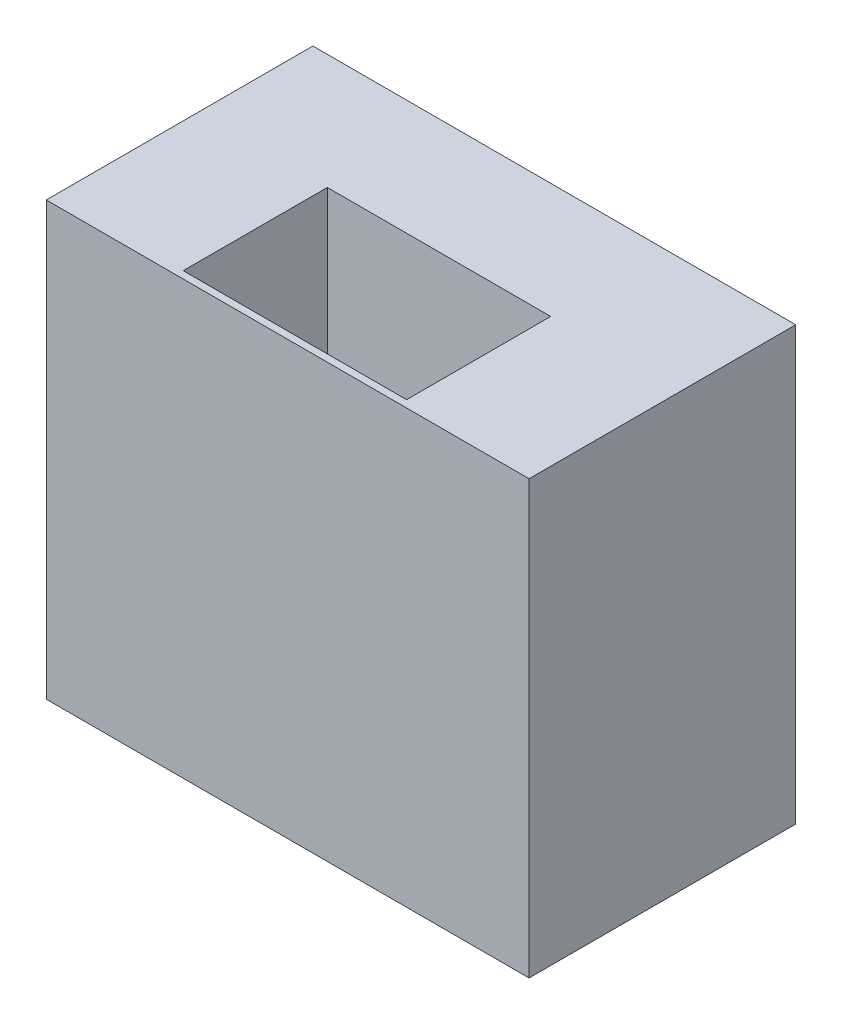
from build123d import *

# Parameters (mm, degrees)
SKETCH1_W                      = 134
SKETCH1_H                      = 74
SKETCH1_W_2                    = 62
SKETCH1_H_2                    = 40
BOSS_EXTRUDE1_DEPTH            = 120
CUT_EXTRUDE1_DEPTH             = 30
SKETCH4_W                      = 32
SKETCH4_H                      = 58
CUT_EXTRUDE2_DEPTH             = 42
SKETCH5_W                      = 32
SKETCH5_H                      = 116
CUT_EXTRUDE3_DEPTH             = 42
M2_5_CLEARANCE_HOLE1_D         = 2.9
M2_5_CLEARANCE_HOLE1_DEPTH     = 14
M2_5_CLEARANCE_HOLE1_TIP       = 0.386628252
SKETCH9_W                      = 40
SKETCH9_H                      = 56
CUT_EXTRUDE9_DEPTH             = 32
CUT_EXTRUDE5_DEPTH             = 20
CUT_EXTRUDE6_DEPTH             = 10
SKETCH12_W                     = 5
SKETCH12_H                     = 10
BOSS_EXTRUDE2_DEPTH            = 10
SKETCH13_R                     = 2.5
BOSS_EXTRUDE4_DEPTH            = 15
SKETCH14_W                     = 5
SKETCH14_H                     = 10
BOSS_EXTRUDE3_DEPTH            = 19.99
SKETCH17_W                     = 10
SKETCH17_H                     = 10
CUT_EXTRUDE10_DEPTH            = 5
SKETCH18_R                     = 2.5
BOSS_EXTRUDE5_DEPTH            = 15
CUT_EXTRUDE11_START            = -5
SKETCH19_R                     = 2.5
SKETCH19_R_2                   = 0.75
CUT_EXTRUDE11_DEPTH            = 5
SKETCH24_W                     = 5.919805253
SKETCH24_H                     = 2
BOSS_EXTRUDE6_DEPTH            = 10
CUT_EXTRUDE14_REACH            = 146.395
SKETCH26_W                     = 10
SKETCH26_H                     = 2.941902197
BOSS_EXTRUDE7_DEPTH            = 10
CUT_EXTRUDE15_REACH            = 146.819
SKETCH30_W                     = 3.947736589
SKETCH30_H                     = 10
BOSS_EXTRUDE8_DEPTH            = 10
CUT_EXTRUDE18_REACH            = 176.552
SKETCH33_W                     = 42
SKETCH33_H                     = 58
SKETCH33_W_2                   = 40
SKETCH33_H_2                   = 56
CUT_EXTRUDE20_DEPTH            = 2
CUT_EXTRUDE21_REACH            = 151.943
SKETCH34_R                     = 2
SKETCH36_W                     = 3
SKETCH36_H                     = 4
SUPORTE_DA_TAMPA_PILHA_DEPTH   = 5
SKETCH37_W                     = 3
SKETCH37_H                     = 3
SUPORTE_DA_TAMPA_2_PILHA_DEPTH = 4


with BuildPart() as part:
    # Sketch1 → Boss-Extrude1 (new body)
    with BuildSketch(Plane(origin=(0, 0, 0), x_dir=(1, 0, 0), z_dir=(0, 1, 0))):
        with Locations((11.401433692, -11.808243728)):
            Rectangle(SKETCH1_W, SKETCH1_H)
        with Locations((11.401433692, -26.808243728)):
            Rectangle(SKETCH1_W_2, SKETCH1_H_2, mode=Mode.SUBTRACT)
    extrude(amount=-BOSS_EXTRUDE1_DEPTH)

    # Sketch2 → Cut-Extrude1 (cut)
    with BuildSketch(Plane(origin=(0, 0, -25.191756272), x_dir=(-1, 0, 0), z_dir=(0, 0, -1))):
        Polygon((21.598566308, -118), (-64.401433692, -118), (-64.401433692, -106), (-76.401433692, -106), (-76.401433692, -14), (-64.401433692, -14), (-64.401433692, -2), (41.598566308, -2), (41.598566308, -14), (53.598566308, -14), (53.598566308, -88), (21.598566308, -88), align=None)
    extrude(amount=-CUT_EXTRUDE1_DEPTH, mode=Mode.SUBTRACT)

    # Sketch4 → Cut-Extrude2 (cut)
    with BuildSketch(Plane(origin=(0, 0, 4.808243728), x_dir=(-1, 0, 0), z_dir=(0, 0, -1))):
        with Locations((37.598566308, -31)):
            Rectangle(SKETCH4_W, SKETCH4_H)
    extrude(amount=-CUT_EXTRUDE2_DEPTH, mode=Mode.SUBTRACT)

    # Sketch5 → Cut-Extrude3 (cut)
    with BuildSketch(Plane(origin=(0, 0, 4.808243728), x_dir=(-1, 0, 0), z_dir=(0, 0, -1))):
        with Locations((-60.401433692, -60)):
            Rectangle(SKETCH5_W, SKETCH5_H)
    extrude(amount=-CUT_EXTRUDE3_DEPTH, mode=Mode.SUBTRACT)

    # M2.5 Clearance Hole1
    with Locations(Plane(origin=(0, 0, -25.191756272), x_dir=(-1, 0, 0), z_dir=(0, 0, -1))):
        with Locations((-70.401433692, -8), (47.598566308, -8), (47.598566308, -112), (-70.401433692, -112)):
            Hole(M2_5_CLEARANCE_HOLE1_D / 2, depth=M2_5_CLEARANCE_HOLE1_DEPTH)
            with Locations((0, 0, -(M2_5_CLEARANCE_HOLE1_DEPTH + M2_5_CLEARANCE_HOLE1_TIP / 2))):  # 150.14° drill point
                Cone(0, M2_5_CLEARANCE_HOLE1_D / 2, M2_5_CLEARANCE_HOLE1_TIP, mode=Mode.SUBTRACT)

    # Sketch9 → Cut-Extrude9 (cut)
    with BuildSketch(Plane.ZY.offset(55.598566308)):
        with Locations((26.808243728, -90)):
            Rectangle(SKETCH9_W, SKETCH9_H)
    extrude(amount=-CUT_EXTRUDE9_DEPTH, mode=Mode.SUBTRACT)

    # Sketch10 → Cut-Extrude5 (cut)
    with BuildSketch(Plane(origin=(0, 0, -25.191756272), x_dir=(-1, 0, 0), z_dir=(0, 0, -1))):
        Polygon((21.598566308, -88), (53.598566308, -88), (53.598566308, -106), (41.598566308, -106), (41.598566308, -118), (21.598566308, -118), align=None)
    extrude(amount=-CUT_EXTRUDE5_DEPTH, mode=Mode.SUBTRACT)

    # Sketch11 → Cut-Extrude6 (cut)
    with BuildSketch(Plane(origin=(0, 0, -5.191756272), x_dir=(-1, 0, 0), z_dir=(0, 0, -1))):
        Polygon((53.598566308, -88), (21.598566308, -88), (21.598566308, -118), (41.598566308, -118), (41.598566308, -106), (53.598566308, -106), align=None)
    extrude(amount=-CUT_EXTRUDE6_DEPTH, mode=Mode.SUBTRACT)

    # Sketch12 → Boss-Extrude2 (add)
    with BuildSketch(Plane(origin=(44.401433692, 0, 0), x_dir=(0, 0, -1), z_dir=(1, 0, 0))):
        with Locations((-7.308243728, -7)):
            Rectangle(SKETCH12_W, SKETCH12_H)
        with Locations((-7.308243728, -113)):
            Rectangle(SKETCH12_W, SKETCH12_H)
    extrude(amount=BOSS_EXTRUDE2_DEPTH)

    # Sketch13 → Boss-Extrude4 (add)
    with BuildSketch(Plane(origin=(0, 0, 4.808243728), x_dir=(-1, 0, 0), z_dir=(0, 0, -1))):
        with Locations(Location((-49.401433692, -7, 0), (0, 0, 180))):
            Circle(SKETCH13_R)
        with Locations(Location((-49.401433692, -113, 0), (0, 0, 180))):
            Circle(SKETCH13_R)
    extrude(amount=BOSS_EXTRUDE4_DEPTH)

    # Sketch14 → Boss-Extrude3 (add)
    with BuildSketch(Plane.ZY.offset(21.598566308)):
        with Locations((7.308243728, -7)):
            Rectangle(SKETCH14_W, SKETCH14_H)
    extrude(amount=BOSS_EXTRUDE3_DEPTH)

    # Sketch17 → Cut-Extrude10 (cut)
    with BuildSketch(Plane(origin=(0, 0, 4.808243728), x_dir=(-1, 0, 0), z_dir=(0, 0, -1))):
        with Locations((26.598566308, -7)):
            Rectangle(SKETCH17_W, SKETCH17_H)
    extrude(amount=-CUT_EXTRUDE10_DEPTH, mode=Mode.SUBTRACT)

    # Sketch18 → Boss-Extrude5 (add)
    with BuildSketch(Plane(origin=(0, 0, 4.808243728), x_dir=(-1, 0, 0), z_dir=(0, 0, -1))):
        with Locations((36.598571318, -7)):
            Circle(SKETCH18_R)
        with Locations((37.337526325, -113.738960016)):
            Circle(SKETCH18_R)
    extrude(amount=BOSS_EXTRUDE5_DEPTH)

    # Sketch19 → Cut-Extrude11 (cut)
    # profile 1 of 4: a face of its own
    with BuildSketch(Plane(origin=(0, 0, -10.191756272), x_dir=(-1, 0, 0), z_dir=(0, 0, -1)).offset(CUT_EXTRUDE11_START)):
        with Locations(Location((-49.401433692, -113, 0), (0, 0, 180))):
            Circle(SKETCH19_R)
        with Locations((-49.401433692, -113)):
            Circle(SKETCH19_R_2, mode=Mode.SUBTRACT)
    # profile 2 of 4: a face of its own
    with BuildSketch(Plane(origin=(0, 0, -10.191756272), x_dir=(-1, 0, 0), z_dir=(0, 0, -1)).offset(CUT_EXTRUDE11_START)):
        with Locations(Location((-49.401433692, -7, 0), (0, 0, 180))):
            Circle(SKETCH19_R)
        with Locations((-49.401433692, -7)):
            Circle(SKETCH19_R_2, mode=Mode.SUBTRACT)
    # profile 3 of 4: a face of its own
    with BuildSketch(Plane(origin=(0, 0, -10.191756272), x_dir=(-1, 0, 0), z_dir=(0, 0, -1)).offset(CUT_EXTRUDE11_START)):
        with Locations((36.598571318, -7)):
            Circle(SKETCH19_R)
        with Locations((36.598571318, -7)):
            Circle(SKETCH19_R_2, mode=Mode.SUBTRACT)
    # profile 4 of 4: a face of its own
    with BuildSketch(Plane(origin=(0, 0, -10.191756272), x_dir=(-1, 0, 0), z_dir=(0, 0, -1)).offset(CUT_EXTRUDE11_START)):
        with Locations((37.337526325, -113.738960016)):
            Circle(SKETCH19_R)
        with Locations((37.337526325, -113.738960016)):
            Circle(SKETCH19_R_2, mode=Mode.SUBTRACT)
    extrude(amount=CUT_EXTRUDE11_DEPTH, mode=Mode.SUBTRACT)

    # Sketch24 → Boss-Extrude6 (add)
    with BuildSketch(Plane.XY.offset(9.808243728)):
        with Locations((47.361336319, -8)):
            Rectangle(SKETCH24_W, SKETCH24_H)
    extrude(amount=BOSS_EXTRUDE6_DEPTH)

    # Sketch25 → Cut-Extrude14 (cut, up to next)
    with BuildSketch(Plane.XZ.offset(9), mode=Mode.PRIVATE) as cut_extrude14_sk1:
        Polygon((50.321238945, 9.808243728), (44.401433692, 19.808243728), (50.321238945, 19.808243728), align=None)
    cut_extrude14_tool1 = extrude(cut_extrude14_sk1.sketch, amount=-CUT_EXTRUDE14_REACH, mode=Mode.PRIVATE) & part.part
    add(cut_extrude14_tool1.solids().sort_by_distance((48.347971, -9, 16.47491))[0], mode=Mode.SUBTRACT)

    # Sketch26 → Boss-Extrude7 (add)
    with BuildSketch(Plane.XY.offset(9.808243728)):
        with Locations((49.401433692, -113.021848151)):
            Rectangle(SKETCH26_W, SKETCH26_H)
    extrude(amount=BOSS_EXTRUDE7_DEPTH)

    # Sketch27 → Cut-Extrude15 (cut, up to next)
    with BuildSketch(Plane(origin=(0, -111.550897052, 0), x_dir=(1, 0, 0), z_dir=(0, 1, 0)), mode=Mode.PRIVATE) as cut_extrude15_sk1:
        Polygon((54.401433692, -9.808243728), (44.401433692, -19.808243728), (54.401433692, -19.808243728), align=None)
    cut_extrude15_tool1 = extrude(cut_extrude15_sk1.sketch, amount=-CUT_EXTRUDE15_REACH, mode=Mode.PRIVATE) & part.part
    add(cut_extrude15_tool1.solids().sort_by_distance((51.0681, -111.550897, 16.47491))[0], mode=Mode.SUBTRACT)

    # Sketch30 → Boss-Extrude8 (add)
    with BuildSketch(Plane.XY.offset(9.808243728)):
        with Locations((-36.612321656, -7)):
            Rectangle(SKETCH30_W, SKETCH30_H)
    extrude(amount=BOSS_EXTRUDE8_DEPTH)

    # Sketch31 → Cut-Extrude18 (cut, up to next)
    with BuildSketch(Plane.ZY.offset(38.58618995), mode=Mode.PRIVATE) as cut_extrude18_sk1:
        Polygon((19.808243728, -2), (19.808243728, -12), (9.808243728, -12), align=None)
    cut_extrude18_tool1 = extrude(cut_extrude18_sk1.sketch, amount=-CUT_EXTRUDE18_REACH, mode=Mode.PRIVATE) & part.part
    add(cut_extrude18_tool1.solids().sort_by_distance((-38.58619, -8.666667, 16.47491))[0], mode=Mode.SUBTRACT)

    # Sketch33 → Cut-Extrude20 (cut)
    with BuildSketch(Plane.ZY.offset(55.598566308)):
        with Locations((26.808243728, -90)):
            Rectangle(SKETCH33_W, SKETCH33_H)
        with Locations((26.808243728, -90)):
            Rectangle(SKETCH33_W_2, SKETCH33_H_2, mode=Mode.SUBTRACT)
    extrude(amount=-CUT_EXTRUDE20_DEPTH, mode=Mode.SUBTRACT)

    # Sketch34 → Cut-Extrude21 (cut, up to next)
    with BuildSketch(Plane(origin=(0, 0, 4.808243728), x_dir=(-1, 0, 0), z_dir=(0, 0, -1)), mode=Mode.PRIVATE) as cut_extrude21_sk1:
        with Locations((37.530823831, -66.434778505)):
            Circle(SKETCH34_R)
    cut_extrude21_tool1 = extrude(cut_extrude21_sk1.sketch, amount=-CUT_EXTRUDE21_REACH, mode=Mode.PRIVATE) & part.part
    add(cut_extrude21_tool1.solids().sort_by_distance((-37.530824, -66.434779, 4.808244))[0], mode=Mode.SUBTRACT)

    # Sketch36 → Suporte da Tampa - Pilha (add)
    with BuildSketch(Plane(origin=(0, 0, 46.808243728), x_dir=(-1, 0, 0), z_dir=(0, 0, -1))):
        with Locations((49.098566308, -116)):
            Rectangle(SKETCH36_W, SKETCH36_H)
        with Locations((49.098566308, -64)):
            Rectangle(SKETCH36_W, SKETCH36_H)
    extrude(amount=SUPORTE_DA_TAMPA_PILHA_DEPTH)

    # Sketch37 → Suporte da Tampa 2 - Pilha (add)
    with BuildSketch(Plane.XY.offset(6.808243728)):
        with Locations((-49.098566308, -116.5)):
            Rectangle(SKETCH37_W, SKETCH37_H)
        with Locations((-49.098566308, -63.5)):
            Rectangle(SKETCH37_W, SKETCH37_H)
    extrude(amount=SUPORTE_DA_TAMPA_2_PILHA_DEPTH)


solid = part.part
